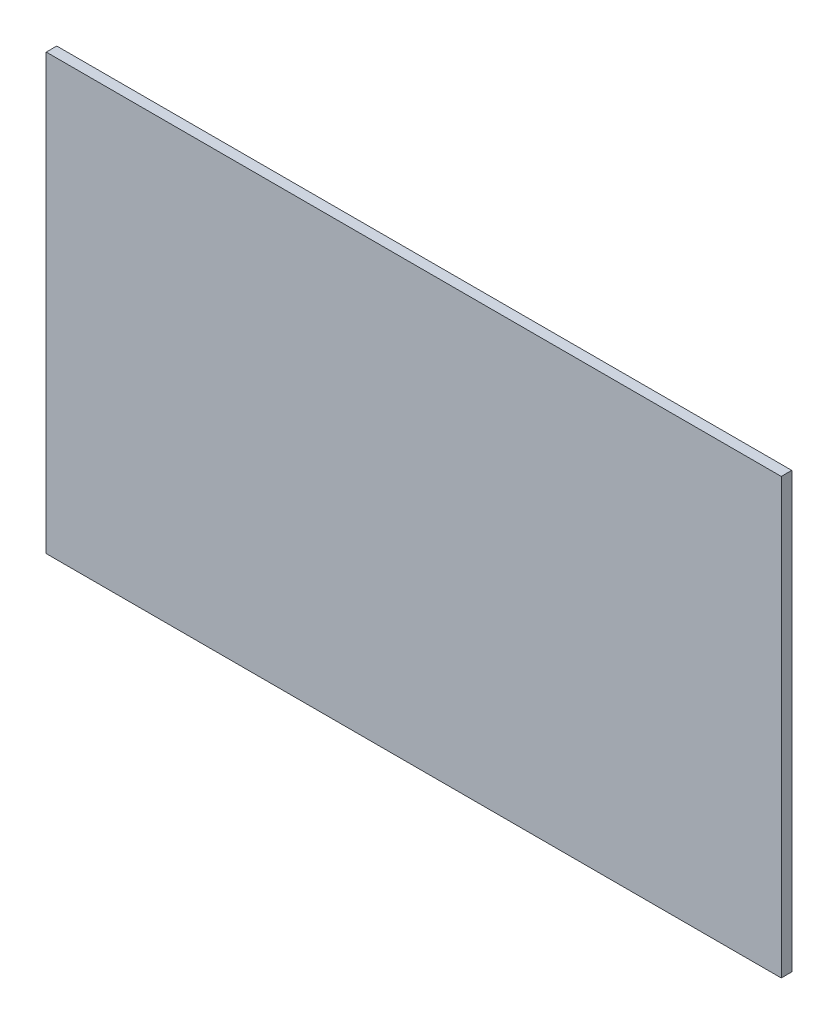
from build123d import *

# Parameters (mm, degrees)
SKETCH1_W           = 177.8
SKETCH1_H           = 105.0798
BOSS_EXTRUDE1_DEPTH = 2.54


with BuildPart() as part:
    # Sketch1 → Boss-Extrude1 (new body)
    with BuildSketch(Plane.XY):
        Rectangle(SKETCH1_W, SKETCH1_H)
    extrude(amount=BOSS_EXTRUDE1_DEPTH)


solid = part.part
